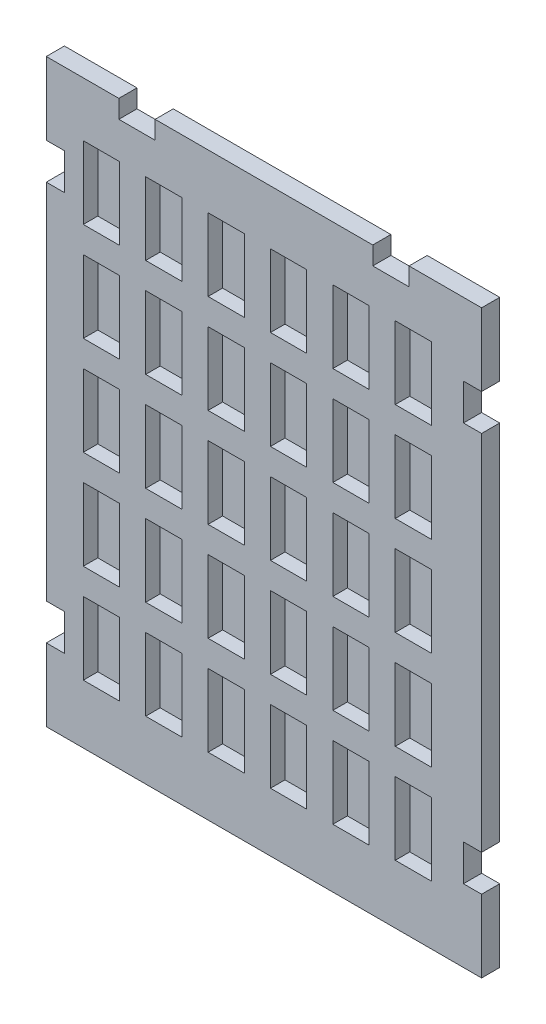
from build123d import *

# Parameters (mm, degrees)
BOSS_EXTRUDE1_DEPTH  = 3.175
SKETCH2_W            = 6.35
SKETCH2_H            = 12.7
CUT_EXTRUDE1_DEPTH   = 2.54
LPATTERN1_COUNT      = 6
LPATTERN1_PITCH      = 10.922
LPATTERN1_COUNT_DIR2 = 5
LPATTERN1_PITCH_DIR2 = 17.272


with BuildPart() as part:
    # Sketch1 → Boss-Extrude1 (new body)
    with BuildSketch(Plane.XY):
        Polygon((0, -101.6), (12.7, -101.6), (63.5, -101.6), (76.2, -101.6), (76.2, -88.9), (73.025, -88.9), (73.025, -82.55), (76.2, -82.55), (76.2, -19.05), (73.025, -19.05), (73.025, -12.7), (76.2, -12.7), (76.2, 0), (63.5, 0), (63.5, -3.175), (57.15, -3.175), (57.15, 0), (19.05, 0), (19.05, -3.175), (12.7, -3.175), (12.7, 0), (0, 0), (0, -12.7), (3.175, -12.7), (3.175, -19.05), (0, -19.05), (0, -82.55), (3.175, -82.55), (3.175, -88.9), (0, -88.9), align=None)
    extrude(amount=BOSS_EXTRUDE1_DEPTH)

    # Sketch2 → Cut-Extrude1 (cut)
    with BuildSketch(Plane.XY.offset(3.175)):
        with Locations((9.652, -15.875)):
            Rectangle(SKETCH2_W, SKETCH2_H)
    cut_extrude1 = extrude(amount=-CUT_EXTRUDE1_DEPTH, mode=Mode.SUBTRACT)

    # LPattern1: Cut-Extrude1 6 × 5
    with Locations(*[(i * LPATTERN1_PITCH, -j * LPATTERN1_PITCH_DIR2, 0) for i in range(LPATTERN1_COUNT) for j in range(LPATTERN1_COUNT_DIR2) if (i, j) != (0, 0)]):
        add(cut_extrude1, mode=Mode.SUBTRACT)


solid = part.part
